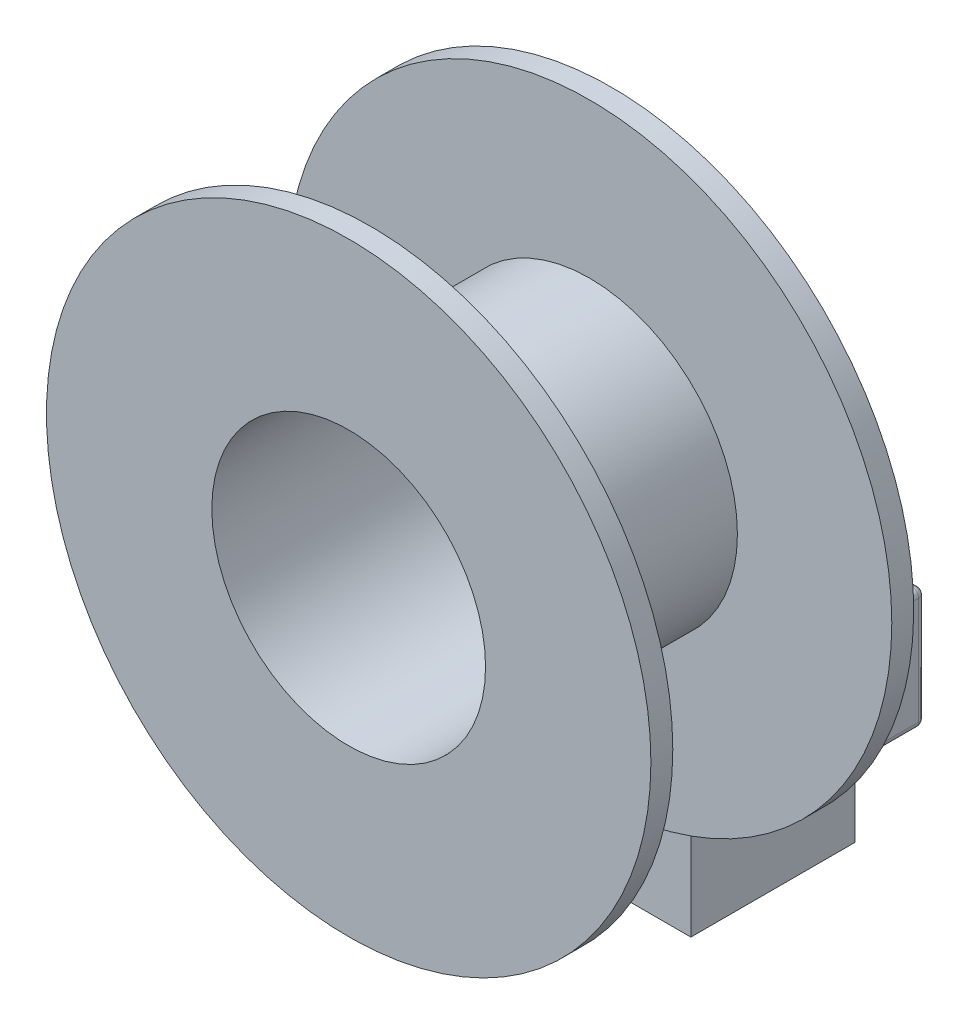
from build123d import *

# Parameters (mm, degrees)
SKETCH_1_R           = 13.8
SKETCH_1_R_2         = 6.25
EXTRUDE_1_DEPTH      = 1
SKETCH_2_R           = 6.75
SKETCH_2_R_2         = 6.25
EXTRUDE_2_DEPTH      = 10
SKETCH_3_R           = 13.8
SKETCH_3_R_2         = 6.25
EXTRUDE_3_DEPTH      = 1
EXTRUDE_4_DEPTH      = 7
EXTRUDE_4_DEPTH_BACK = 0.5
SKETCH_4_W           = 8.25
SKETCH_4_H           = 8.5
SKETCH_5_W           = 8.25
SKETCH_5_H           = 5.5
EXTRUDE_5_DEPTH      = 3.2
FILLET_1_R           = 0.3


with BuildPart() as part:
    # Эскиз1 → Бобышка-Вытянуть1 (new body)
    with BuildSketch(Plane.XY):
        Circle(SKETCH_1_R)
        Circle(SKETCH_1_R_2, mode=Mode.SUBTRACT)
    extrude(amount=EXTRUDE_1_DEPTH)

    # Эскиз2 → Бобышка-Вытянуть2 (add)
    with BuildSketch(Plane.XY.offset(1)):
        Circle(SKETCH_2_R)
        Circle(SKETCH_2_R_2, mode=Mode.SUBTRACT)
    extrude(amount=EXTRUDE_2_DEPTH)

    # Эскиз3 → Бобышка-Вытянуть3 (add)
    with BuildSketch(Plane.XY.offset(11)):
        Circle(SKETCH_3_R)
        Circle(SKETCH_3_R_2, mode=Mode.SUBTRACT)
    extrude(amount=EXTRUDE_3_DEPTH)

    # Эскиз4 → Бобышка-Вытянуть4 (add, two sides: drawn at the far end of the back side and taken through both)
    with BuildSketch(Plane(origin=(0, 0, 0), x_dir=(-1, 0, 0), z_dir=(0, 0, -1)).offset(-EXTRUDE_4_DEPTH_BACK)):
        with Locations((0, -13.25)):
            Rectangle(SKETCH_4_W, SKETCH_4_H)
    extrude(amount=EXTRUDE_4_DEPTH + EXTRUDE_4_DEPTH_BACK)

    # Эскиз5 → Бобышка-Вытянуть5 (add)
    with BuildSketch(Plane(origin=(0, 0, -7), x_dir=(-1, 0, 0), z_dir=(0, 0, -1))):
        with Locations((0, -11.75)):
            Rectangle(SKETCH_5_W, SKETCH_5_H)
    extrude(amount=EXTRUDE_5_DEPTH)

    # Скругление1
    fillet_1_edges = [part.edges().sort_by_distance(p)[0] for p in [
        (4.125, -9, -5.1),
        (-4.125, -9, -5.1),
        (4.125, -14.5, -8.6),
        (-4.125, -14.5, -8.6),
        (4.125, -11.75, -10.2),
        (0, -14.5, -10.2),
        (-4.125, -11.75, -10.2),
        (0, -9, -10.2),
    ]]
    fillet(fillet_1_edges, radius=FILLET_1_R)


solid = part.part
